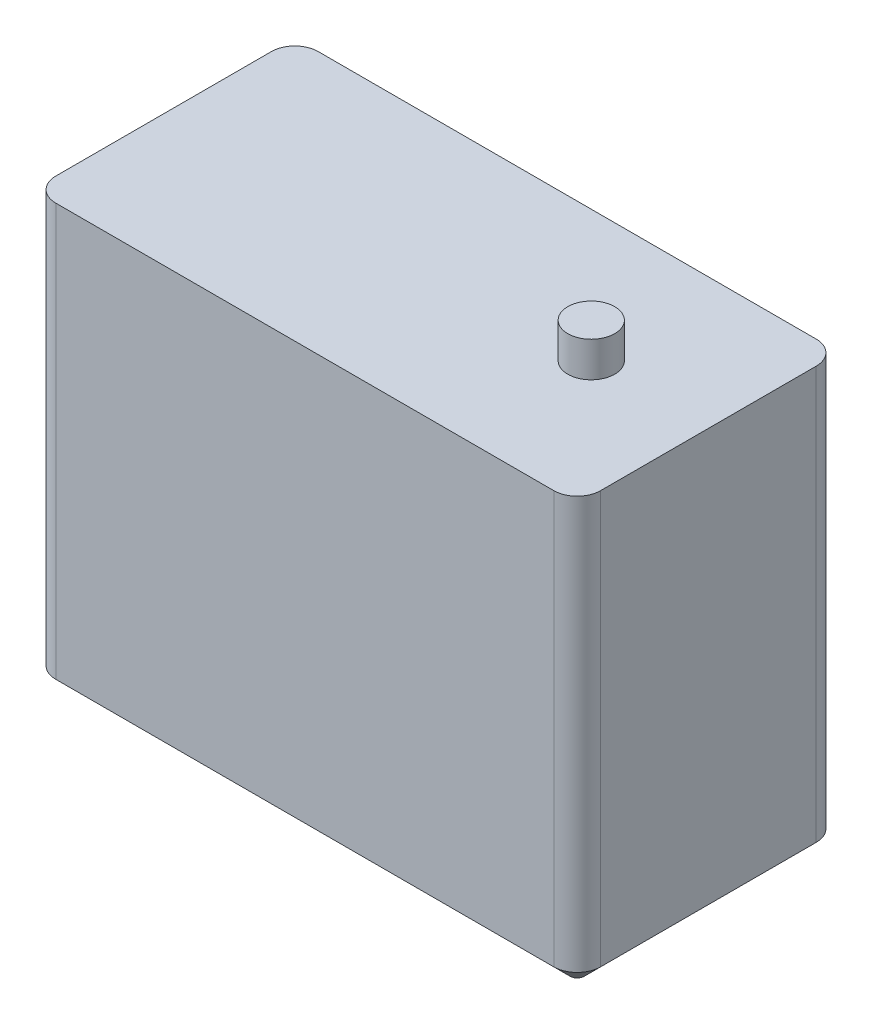
from build123d import *

# Parameters (mm, degrees)
SKETCH1_W           = 59.055
SKETCH1_H           = 28.448
BOSS_EXTRUDE1_DEPTH = 46.482
SKETCH2_R           = 2.54
BOSS_EXTRUDE2_DEPTH = 3.81
FILLET1_R           = 2.54
CHAMFER1_SIZE       = 1.778


with BuildPart() as part:
    # Sketch1 → Boss-Extrude1 (new body)
    with BuildSketch(Plane(origin=(0, 0, 0), x_dir=(1, 0, 0), z_dir=(0, 1, 0))):
        with Locations((-2.344011553, -9.758904569)):
            Rectangle(SKETCH1_W, SKETCH1_H)
    extrude(amount=BOSS_EXTRUDE1_DEPTH)

    # Sketch2 → Boss-Extrude2 (add)
    with BuildSketch(Plane(origin=(0, 46.482, 0), x_dir=(1, 0, 0), z_dir=(0, 1, 0))):
        with Locations(Location((14.483488447, -9.758904569, 0), (0, 0, 90))):
            Circle(SKETCH2_R)
    extrude(amount=BOSS_EXTRUDE2_DEPTH)

    # Fillet1
    fillet1_edges = [part.edges().sort_by_distance(p)[0] for p in [
        (-31.871511553, 23.241, -4.465095431),
        (27.183488447, 23.241, -4.465095431),
        (27.183488447, 23.241, 23.982904569),
        (-31.871511553, 23.241, 23.982904569),
    ]]
    fillet(fillet1_edges, radius=FILLET1_R)

    # Chamfer1
    chamfer1_edges = [part.edges().sort_by_distance(p)[0] for p in [
        (-31.871511553, 0, 9.758904569),
        (-2.344011553, 0, -4.465095431),
        (27.183488447, 0, 9.758904569),
        (-2.344011553, 0, 23.982904569),
        (-31.127562777, 0, 23.238955793),
        (26.439539672, 0, 23.238955793),
        (26.439539672, 0, -3.721146655),
        (-31.127562777, 0, -3.721146655),
    ]]
    chamfer(chamfer1_edges, length=CHAMFER1_SIZE)


solid = part.part
